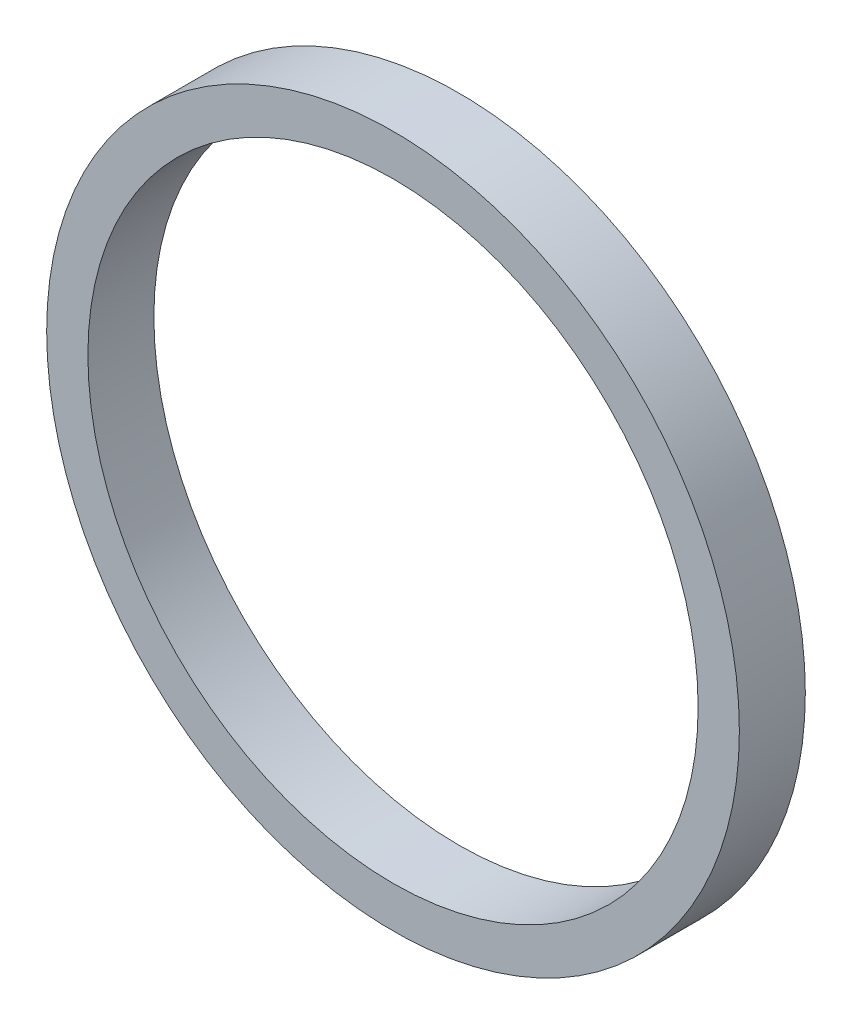
from build123d import *

# Parameters (mm, degrees)
IZIM1_R                     = 2.1
IZIM1_R_2                   = 1.85
Y_KSEKLIK_EKSTR_ZYON1_DEPTH = 0.4


with BuildPart() as part:
    # Çizim1 → Yükseklik-Ekstrüzyon1 (new body)
    with BuildSketch(Plane.XY):
        Circle(IZIM1_R)
        Circle(IZIM1_R_2, mode=Mode.SUBTRACT)
    extrude(amount=Y_KSEKLIK_EKSTR_ZYON1_DEPTH)


solid = part.part
